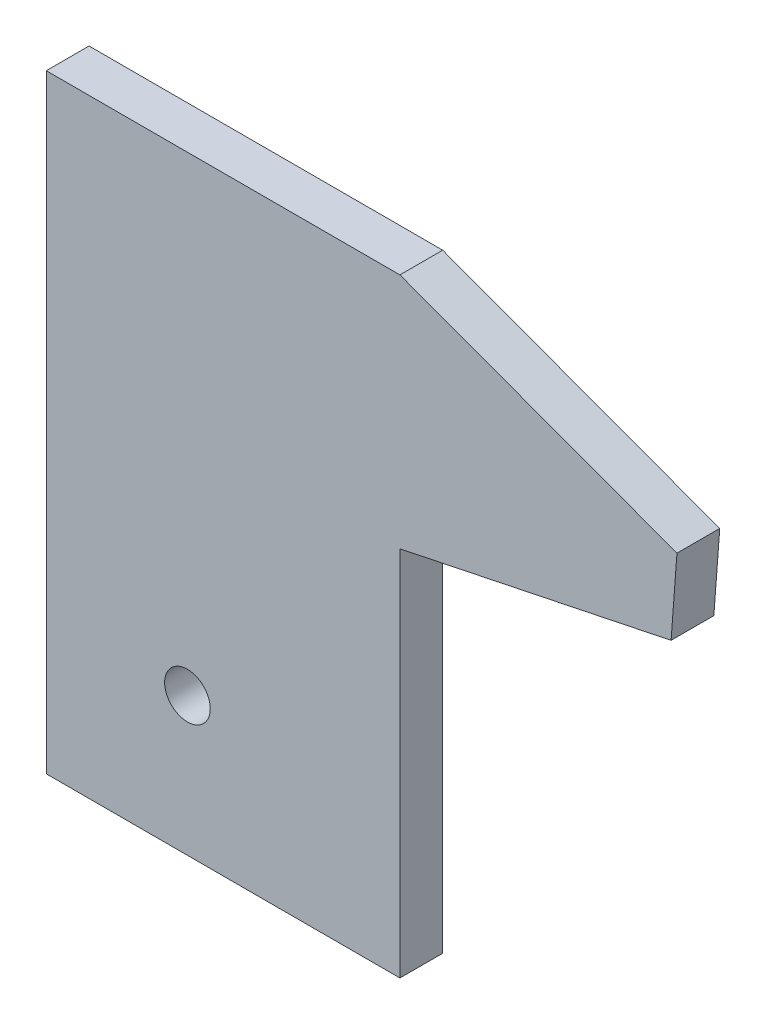
from build123d import *

# Parameters (mm, degrees)
SKETCH1_R           = 1.6
BOSS_EXTRUDE1_DEPTH = 3


with BuildPart() as part:
    # Sketch1 → Boss-Extrude1 (new body)
    with BuildSketch(Plane.XY):
        Polygon((-160.335655897, -67.7), (-185.135655897, -67.7), (-185.135655897, -25), (-160.335655897, -25), (-140.907866476, -32.184754953), (-141.319826379, -37.686502812), (-160.335655897, -41.635194585), align=None)
        with Locations((-175.235655897, -58)):
            Circle(SKETCH1_R, mode=Mode.SUBTRACT)
    extrude(amount=BOSS_EXTRUDE1_DEPTH)


solid = part.part
